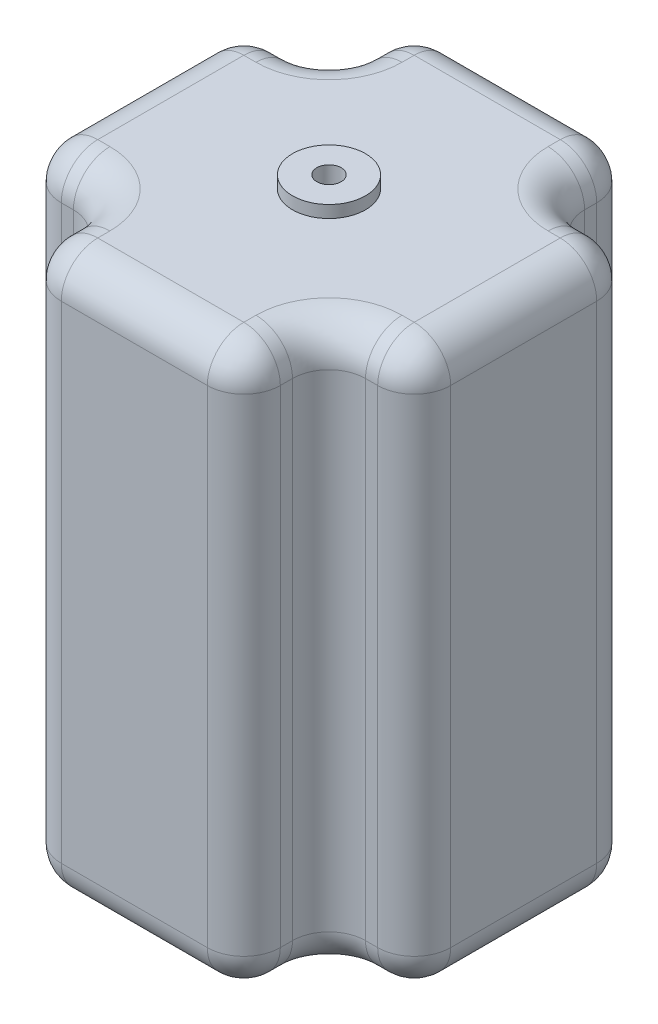
from build123d import *

# Parameters (mm, degrees)
BOSS_EXTRUDE1_DEPTH = 46
FILLET1_R           = 3
SKETCH2_R           = 3
BOSS_EXTRUDE2_DEPTH = 1
SHELL1_T            = -2


with BuildPart() as part:
    # Sketch1 → Boss-Extrude1 (new body)
    with BuildSketch(Plane(origin=(0, 0, 0), x_dir=(1, 0, 0), z_dir=(0, 1, 0))):
        Polygon((-9, 9), (-9, 16), (9, 16), (9, 9), (16, 9), (16, -9), (9, -9), (9, -16), (-9, -16), (-9, -9), (-16, -9), (-16, 9), align=None)
    extrude(amount=BOSS_EXTRUDE1_DEPTH)

    # Fillet1
    fillet1_edges = [part.edges().sort_by_distance(p)[0] for p in [
        (12.5, 0, -9),
        (16, 0, 0),
        (-9, 46, -12.5),
        (12.5, 0, 9),
        (9, 0, 12.5),
        (0, 0, 16),
        (-9, 0, 12.5),
        (-12.5, 0, 9),
        (-16, 0, 0),
        (-12.5, 0, -9),
        (-9, 0, -12.5),
        (0, 0, -16),
        (9, 0, -12.5),
        (-12.5, 46, -9),
        (9, 23, -9),
        (16, 23, -9),
        (16, 23, 9),
        (-16, 46, 0),
        (9, 23, 9),
        (9, 23, 16),
        (-9, 23, 16),
        (-9, 23, 9),
        (-16, 23, 9),
        (-16, 23, -9),
        (-9, 23, -9),
        (-9, 23, -16),
        (9, 23, -16),
        (-12.5, 46, 9),
        (-9, 46, 12.5),
        (0, 46, 16),
        (9, 46, 12.5),
        (12.5, 46, 9),
        (16, 46, 0),
        (12.5, 46, -9),
        (9, 46, -12.5),
        (0, 46, -16),
    ]]
    fillet(fillet1_edges, radius=FILLET1_R)

    # Sketch2 → Boss-Extrude2 (add)
    with BuildSketch(Plane(origin=(0, 46, 0), x_dir=(1, 0, 0), z_dir=(0, 1, 0))):
        with Locations(Location((0, 0, 0), (0, 0, 90))):
            Circle(SKETCH2_R)
    extrude(amount=BOSS_EXTRUDE2_DEPTH)

    # Shell1
    shell1_openings = [part.faces().sort_by_distance(p)[0] for p in [
        (0, 47, 0),
    ]]
    offset(amount=SHELL1_T, openings=shell1_openings, kind=Kind.INTERSECTION)


solid = part.part
